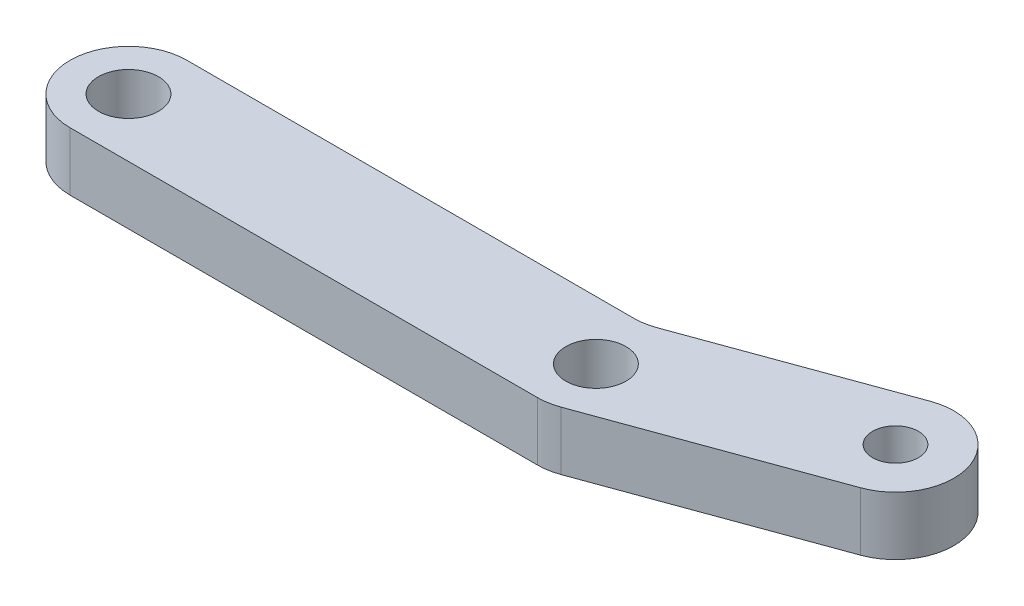
from build123d import *

# Parameters (mm, degrees)
SKETCH1_R           = 3.2639
BOSS_EXTRUDE1_DEPTH = 3.175
BOSS_EXTRUDE2_START = -6.35
SKETCH3_R           = 2.4892
BOSS_EXTRUDE2_DEPTH = 6.35
FILLET2_R           = 6.35


with BuildPart() as part:
    # Sketch1 → Boss-Extrude1 (new, symmetric)
    with BuildSketch(Plane(origin=(0, 0, 0), x_dir=(1, 0, 0), z_dir=(0, 1, 0))):
        with BuildLine():
            Line((0, 6.35), (50.8, 6.35))
            ThreePointArc((50.8, 6.35), (57.15, 0), (50.8, -6.35))
            Line((50.8, -6.35), (0, -6.35))
            ThreePointArc((0, -6.35), (-6.35, 0), (0, 6.35))
        make_face()
        with Locations(Location((0, 0, 0), (0, 0, 270))):
            Circle(SKETCH1_R, mode=Mode.SUBTRACT)
        with Locations(Location((50.8, 0, 0), (0, 0, 270))):
            Circle(SKETCH1_R, mode=Mode.SUBTRACT)
    extrude(amount=BOSS_EXTRUDE1_DEPTH, both=True)

    # Sketch3 → Boss-Extrude2 (add)
    with BuildSketch(Plane.XZ.offset(3.175).offset(BOSS_EXTRUDE2_START)):
        with BuildLine():
            Line((76.840020478, -2.720263498), (52.97182791, 5.967048142))
            ThreePointArc((52.97182791, 5.967048142), (57.053529232, -1.102665928), (50.8, -6.35))
            Line((50.8, -6.35), (49.680323673, -6.35))
            Line((49.680323673, -6.35), (72.496364658, -14.654359782))
            ThreePointArc((72.496364658, -14.654359782), (80.63524071, -10.859139551), (76.840020478, -2.720263498))
        make_face()
        with Locations(Location((74.668192568, -8.68731164, 0), (0, 0, 270))):
            Circle(SKETCH3_R, mode=Mode.SUBTRACT)
    extrude(amount=BOSS_EXTRUDE2_DEPTH)

    # Fillet2
    fillet2_edges = [part.edges().sort_by_distance(p)[0] for p in [
        (49.680323673, 0, -6.35),
    ]]
    fillet(fillet2_edges, radius=FILLET2_R)


solid = part.part
